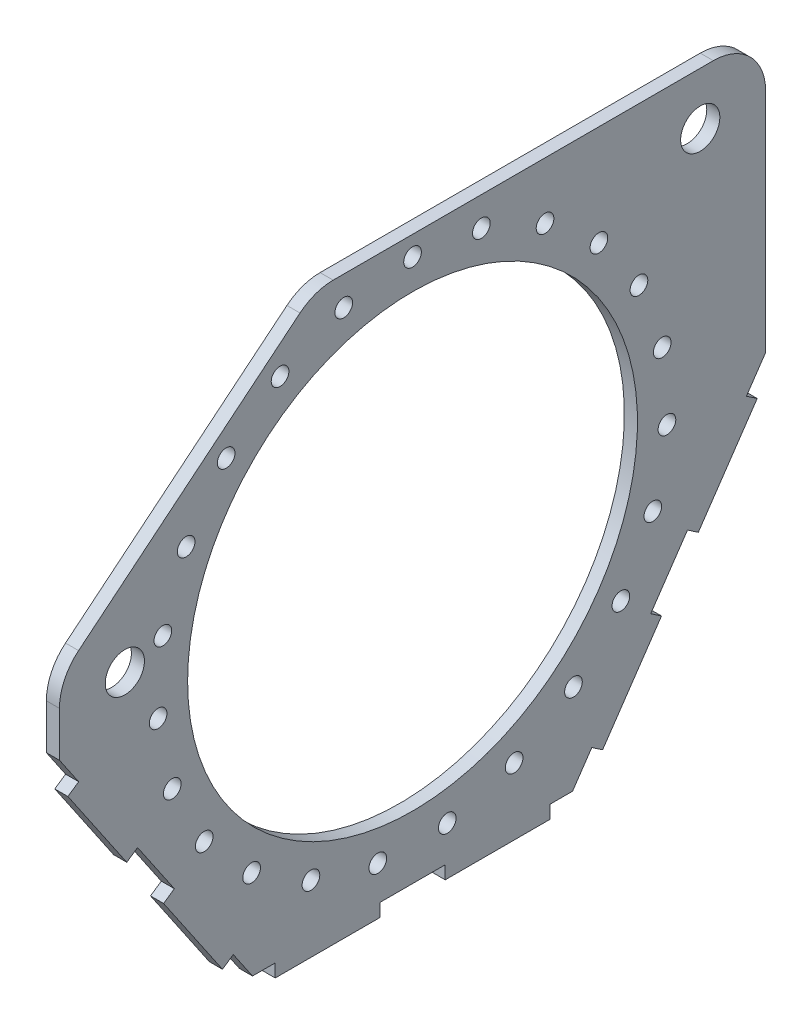
from build123d import *

# Parameters (mm, degrees)
ESQUISSE1_R             = 15
BOSS_EXTRU_1_DEPTH      = 10
ESQUISSE5_R             = 6.75
ESQUISSE5_R_2           = 172
ENL_V_MAT_EXTRU_1_DEPTH = 10
CONG_1_R                = 40
ENL_V_MAT_EXTRU_2_DEPTH = 10


with BuildPart() as part:
    # Esquisse1 → Boss.-Extru.1 (new body)
    with BuildSketch(Plane(origin=(0, 0, 0), x_dir=(0, 0, -1), z_dir=(1, 0, 0))):
        Polygon((540, 0), (540, 340), (195, 340), (0, 180), (0, 0), (0, -100), (540, -100), align=None)
        with Locations((490, 300)):
            Circle(ESQUISSE1_R, mode=Mode.SUBTRACT)
        with Locations((50, 160)):
            Circle(ESQUISSE1_R, mode=Mode.SUBTRACT)
    extrude(amount=BOSS_EXTRU_1_DEPTH)

    # Esquisse5 → Enlèv. mat.-Extru.1 (cut)
    with BuildSketch(Plane.ZY):
        with Locations((-270, 325)):
            Circle(ESQUISSE5_R)
        with Locations((-217.389629624, 317.768871033)):
            Circle(ESQUISSE5_R)
        with Locations((-270, 130)):
            Circle(ESQUISSE5_R_2)
        with Locations((-168.681129743, 296.611783887)):
            Circle(ESQUISSE5_R)
        with Locations((-127.486986966, 263.097862928)):
            Circle(ESQUISSE5_R)
        with Locations((-96.862382412, 219.712682358)):
            Circle(ESQUISSE5_R)
        with Locations((-79.078602902, 169.673922545)):
            Circle(ESQUISSE5_R)
        with Locations((-75.454590008, 116.692729394)):
            Circle(ESQUISSE5_R)
        with Locations((-86.259120187, 64.698475627)):
            Circle(ESQUISSE5_R)
        with Locations((-110.690870863, 17.547337188)):
            Circle(ESQUISSE5_R)
        with Locations((-146.937850856, -21.263701687)):
            Circle(ESQUISSE5_R)
        with Locations((-192.31178748, -48.856203794)):
            Circle(ESQUISSE5_R)
        with Locations((-243.447503426, -63.183759477)):
            Circle(ESQUISSE5_R)
        with Locations((-296.552496574, -63.183759477)):
            Circle(ESQUISSE5_R)
        with Locations((-347.68821252, -48.856203794)):
            Circle(ESQUISSE5_R)
        with Locations((-393.062149144, -21.263701687)):
            Circle(ESQUISSE5_R)
        with Locations((-429.309129137, 17.547337188)):
            Circle(ESQUISSE5_R)
        with Locations((-453.740879813, 64.698475627)):
            Circle(ESQUISSE5_R)
        with Locations((-464.545409992, 116.692729394)):
            Circle(ESQUISSE5_R)
        with Locations((-460.921397098, 169.673922545)):
            Circle(ESQUISSE5_R)
        with Locations((-443.137617588, 219.712682358)):
            Circle(ESQUISSE5_R)
        with Locations((-412.513013034, 263.097862928)):
            Circle(ESQUISSE5_R)
        with Locations((-371.318870257, 296.611783887)):
            Circle(ESQUISSE5_R)
        with Locations((-322.610370376, 317.768871033)):
            Circle(ESQUISSE5_R)
        Polygon((-397.670371572, -100), (-142.329628428, -100), (0, 108.948461295), (0, -195.189428583), (-540, -195.189428583), (-540, 108.948461295), align=None)
    extrude(amount=-ENL_V_MAT_EXTRU_1_DEPTH, mode=Mode.SUBTRACT)

    # Congé1
    cong_1_edges = [part.edges().sort_by_distance(p)[0] for p in [
        (5, 180, 0),
        (5, 340, -195),
        (5, 340, -540),
    ]]
    fillet(cong_1_edges, radius=CONG_1_R)

    # Esquisse6 → Enlèv. mat.-Extru.2 (cut)
    with BuildSketch(Plane(origin=(10, 0, 0), x_dir=(0, 0, -1), z_dir=(1, 0, 0))):
        Polygon((540, -146.209782651), (540, 126.711345971), (525.303280223, 105.135676749), (533.568042486, 99.505960528), (488.530312716, 33.387862422), (480.265550453, 39.017578643), (452.116969346, -2.306232673), (460.381731609, -7.935948894), (415.344001839, -74.054047), (407.079239575, -68.424330778), (392.382519799, -90), (375, -90), (375, -100), (295, -100), (295, -90), (245, -90), (245, -100), (165, -100), (165, -90), (147.617480201, -90), (132.920760425, -68.424330778), (124.655998161, -74.054047), (79.618268391, -7.935948894), (87.883030654, -2.306232673), (59.734449547, 39.017578643), (51.469687284, 33.387862422), (6.431957514, 99.505960528), (14.696719777, 105.135676749), (0, 126.711345971), (0, -146.209782651), align=None)
    extrude(amount=-ENL_V_MAT_EXTRU_2_DEPTH, mode=Mode.SUBTRACT)


solid = part.part
